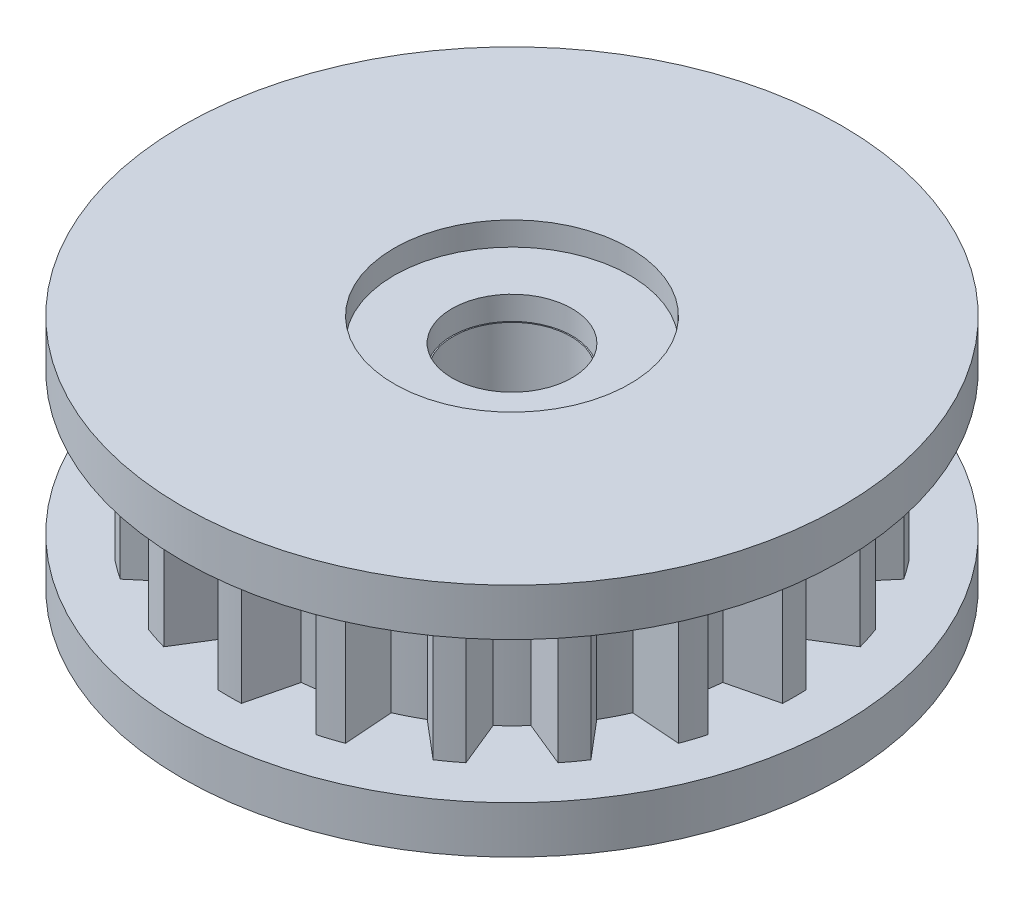
from build123d import *

# Parameters (mm, degrees)
SKETCH1_R           = 2.5
BOSS_EXTRUDE1_DEPTH = 6
SKETCH2_W           = 11.45
SKETCH2_H           = 2
SKETCH3_R           = 5
CUT_EXTRUDE1_DEPTH  = 1


with BuildPart() as part:
    # Sketch1 → Boss-Extrude1 (new body)
    with BuildSketch(Plane(origin=(0, 0, 0), x_dir=(1, 0, 0), z_dir=(0, 1, 0))):
        with BuildLine():
            Line((0.5, 11.989578808), (1, 9.949874371))
            ThreePointArc((1, 9.949874371), (1.56434465, 9.876883406), (2.123623756, 9.771909851))
            Line((2.123623756, 9.771909851), (3.229455349, 11.55727555))
            ThreePointArc((3.229455349, 11.55727555), (3.708203932, 11.412678196), (4.180511865, 11.248258556))
            Line((4.180511865, 11.248258556), (4.025736789, 9.153875863))
            ThreePointArc((4.025736789, 9.153875863), (4.539904997, 8.910065242), (5.039372423, 8.63740271))
            Line((5.039372423, 8.63740271), (6.642789108, 9.993665637))
            ThreePointArc((6.642789108, 9.993665637), (7.053423028, 9.708203932), (7.451806102, 9.405880385))
            Line((7.451806102, 9.405880385), (6.657406412, 7.461832206))
            ThreePointArc((6.657406412, 7.461832206), (7.071067812, 7.071067812), (7.461832206, 6.657406412))
            Line((7.461832206, 6.657406412), (9.405880385, 7.451806102))
            ThreePointArc((9.405880385, 7.451806102), (9.708203932, 7.053423028), (9.993665637, 6.642789108))
            Line((9.993665637, 6.642789108), (8.63740271, 5.039372423))
            ThreePointArc((8.63740271, 5.039372423), (8.910065242, 4.539904997), (9.153875863, 4.025736789))
            Line((9.153875863, 4.025736789), (11.248258556, 4.180511865))
            ThreePointArc((11.248258556, 4.180511865), (11.412678196, 3.708203932), (11.55727555, 3.229455349))
            Line((11.55727555, 3.229455349), (9.771909851, 2.123623756))
            ThreePointArc((9.771909851, 2.123623756), (9.876883406, 1.56434465), (9.949874371, 1))
            Line((9.949874371, 1), (11.989578808, 0.5))
            ThreePointArc((11.989578808, 0.5), (12, 0), (11.989578808, -0.5))
            Line((11.989578808, -0.5), (9.949874371, -1))
            ThreePointArc((9.949874371, -1), (9.876883406, -1.56434465), (9.771909851, -2.123623756))
            Line((9.771909851, -2.123623756), (11.55727555, -3.229455349))
            ThreePointArc((11.55727555, -3.229455349), (11.412678196, -3.708203932), (11.248258556, -4.180511865))
            Line((11.248258556, -4.180511865), (9.153875863, -4.025736789))
            ThreePointArc((9.153875863, -4.025736789), (8.910065242, -4.539904997), (8.63740271, -5.039372423))
            Line((8.63740271, -5.039372423), (9.993665637, -6.642789108))
            ThreePointArc((9.993665637, -6.642789108), (9.708203932, -7.053423028), (9.405880385, -7.451806102))
            Line((9.405880385, -7.451806102), (7.461832206, -6.657406412))
            ThreePointArc((7.461832206, -6.657406412), (7.071067812, -7.071067812), (6.657406412, -7.461832206))
            Line((6.657406412, -7.461832206), (7.451806102, -9.405880385))
            ThreePointArc((7.451806102, -9.405880385), (7.053423028, -9.708203932), (6.642789108, -9.993665637))
            Line((6.642789108, -9.993665637), (5.039372423, -8.63740271))
            ThreePointArc((5.039372423, -8.63740271), (4.539904997, -8.910065242), (4.025736789, -9.153875863))
            Line((4.025736789, -9.153875863), (4.180511865, -11.248258556))
            ThreePointArc((4.180511865, -11.248258556), (3.708203932, -11.412678196), (3.229455349, -11.55727555))
            Line((3.229455349, -11.55727555), (2.123623756, -9.771909851))
            ThreePointArc((2.123623756, -9.771909851), (1.56434465, -9.876883406), (1, -9.949874371))
            Line((1, -9.949874371), (0.5, -11.989578808))
            ThreePointArc((0.5, -11.989578808), (0, -12), (-0.5, -11.989578808))
            Line((-0.5, -11.989578808), (-1, -9.949874371))
            ThreePointArc((-1, -9.949874371), (-1.56434465, -9.876883406), (-2.123623756, -9.771909851))
            Line((-2.123623756, -9.771909851), (-3.229455349, -11.55727555))
            ThreePointArc((-3.229455349, -11.55727555), (-3.708203932, -11.412678196), (-4.180511865, -11.248258556))
            Line((-4.180511865, -11.248258556), (-4.025736789, -9.153875863))
            ThreePointArc((-4.025736789, -9.153875863), (-4.539904997, -8.910065242), (-5.039372423, -8.63740271))
            Line((-5.039372423, -8.63740271), (-6.642789108, -9.993665637))
            ThreePointArc((-6.642789108, -9.993665637), (-7.053423028, -9.708203932), (-7.451806102, -9.405880385))
            Line((-7.451806102, -9.405880385), (-6.657406412, -7.461832206))
            ThreePointArc((-6.657406412, -7.461832206), (-7.071067812, -7.071067812), (-7.461832206, -6.657406412))
            Line((-7.461832206, -6.657406412), (-9.405880385, -7.451806102))
            ThreePointArc((-9.405880385, -7.451806102), (-9.708203932, -7.053423028), (-9.993665637, -6.642789108))
            Line((-9.993665637, -6.642789108), (-8.63740271, -5.039372423))
            ThreePointArc((-8.63740271, -5.039372423), (-8.910065242, -4.539904997), (-9.153875863, -4.025736789))
            Line((-9.153875863, -4.025736789), (-11.248258556, -4.180511865))
            ThreePointArc((-11.248258556, -4.180511865), (-11.412678196, -3.708203932), (-11.55727555, -3.229455349))
            Line((-11.55727555, -3.229455349), (-9.771909851, -2.123623756))
            ThreePointArc((-9.771909851, -2.123623756), (-9.876883406, -1.56434465), (-9.949874371, -1))
            Line((-9.949874371, -1), (-11.989578808, -0.5))
            ThreePointArc((-11.989578808, -0.5), (-12, 0), (-11.989578808, 0.5))
            Line((-11.989578808, 0.5), (-9.949874371, 1))
            ThreePointArc((-9.949874371, 1), (-9.876883406, 1.56434465), (-9.771909851, 2.123623756))
            Line((-9.771909851, 2.123623756), (-11.55727555, 3.229455349))
            ThreePointArc((-11.55727555, 3.229455349), (-11.412678196, 3.708203932), (-11.248258556, 4.180511865))
            Line((-11.248258556, 4.180511865), (-9.153875863, 4.025736789))
            ThreePointArc((-9.153875863, 4.025736789), (-8.910065242, 4.539904997), (-8.63740271, 5.039372423))
            Line((-8.63740271, 5.039372423), (-9.993665637, 6.642789108))
            ThreePointArc((-9.993665637, 6.642789108), (-9.708203932, 7.053423028), (-9.405880385, 7.451806102))
            Line((-9.405880385, 7.451806102), (-7.461832206, 6.657406412))
            ThreePointArc((-7.461832206, 6.657406412), (-7.071067812, 7.071067812), (-6.657406412, 7.461832206))
            Line((-6.657406412, 7.461832206), (-7.451806102, 9.405880385))
            ThreePointArc((-7.451806102, 9.405880385), (-7.053423028, 9.708203932), (-6.642789108, 9.993665637))
            Line((-6.642789108, 9.993665637), (-5.039372423, 8.63740271))
            ThreePointArc((-5.039372423, 8.63740271), (-4.539904997, 8.910065242), (-4.025736789, 9.153875863))
            Line((-4.025736789, 9.153875863), (-4.180511865, 11.248258556))
            ThreePointArc((-4.180511865, 11.248258556), (-3.708203932, 11.412678196), (-3.229455349, 11.55727555))
            Line((-3.229455349, 11.55727555), (-2.123623756, 9.771909851))
            ThreePointArc((-2.123623756, 9.771909851), (-1.56434465, 9.876883406), (-1, 9.949874371))
            Line((-1, 9.949874371), (-0.5, 11.989578808))
            ThreePointArc((-0.5, 11.989578808), (0, 12), (0.5, 11.989578808))
        make_face()
        with Locations(Location((0, 0, 0), (0, 0, 270))):
            Circle(SKETCH1_R, mode=Mode.SUBTRACT)
    extrude(amount=BOSS_EXTRUDE1_DEPTH)

    # Sketch2 → Revolve1 (revolve)
    with BuildSketch(Plane.XY):
        with Locations((8.275, -1)):
            Rectangle(SKETCH2_W, SKETCH2_H)
        with Locations((8.275, 7)):
            Rectangle(SKETCH2_W, SKETCH2_H)
    revolve(axis=Axis((0, -1000, 0), (0, 1, 0)))

    # Sketch3 → Cut-Extrude1 (cut)
    with BuildSketch(Plane(origin=(0, 8, 0), x_dir=(1, 0, 0), z_dir=(0, 1, 0))):
        with Locations(Location((0, 0, 0), (0, 0, 180))):
            Circle(SKETCH3_R)
    extrude(amount=-CUT_EXTRUDE1_DEPTH, mode=Mode.SUBTRACT)


solid = part.part
